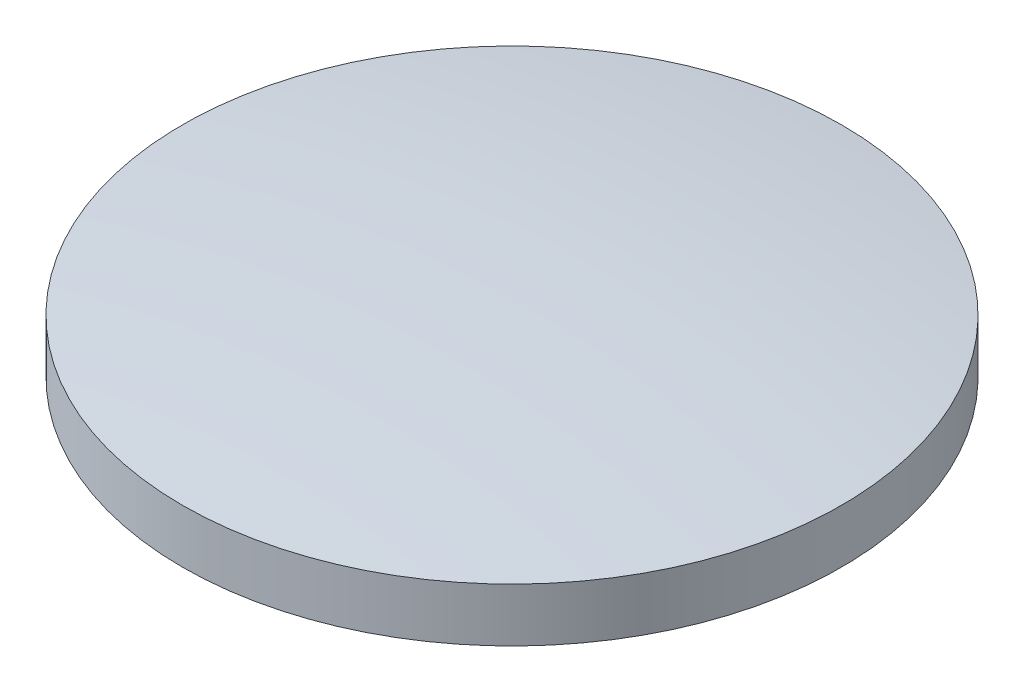
from build123d import *


with BuildPart() as part:
    # Sketch1 → Revolve1 (revolve)
    with BuildSketch(Plane.XY, mode=Mode.PRIVATE) as revolve1_sk:
        with BuildLine():
            Line((45.5, -5.352625516), (45.5, -12.752625516))
            Line((45.5, -12.752625516), (0, -12.752625516))
            Line((0, -12.752625516), (0, -2.252625516))
            ThreePointArc((0, -2.252625516), (22.803292214, -3.020433344), (45.5, -5.352625516))
        make_face()
    revolve(revolve1_sk.sketch.rotate(Axis((0, -12.752625516, 0), (0, 1, 0)), 90), axis=Axis((0, -12.752625516, 0), (0, 1, 0)))


solid = part.part
